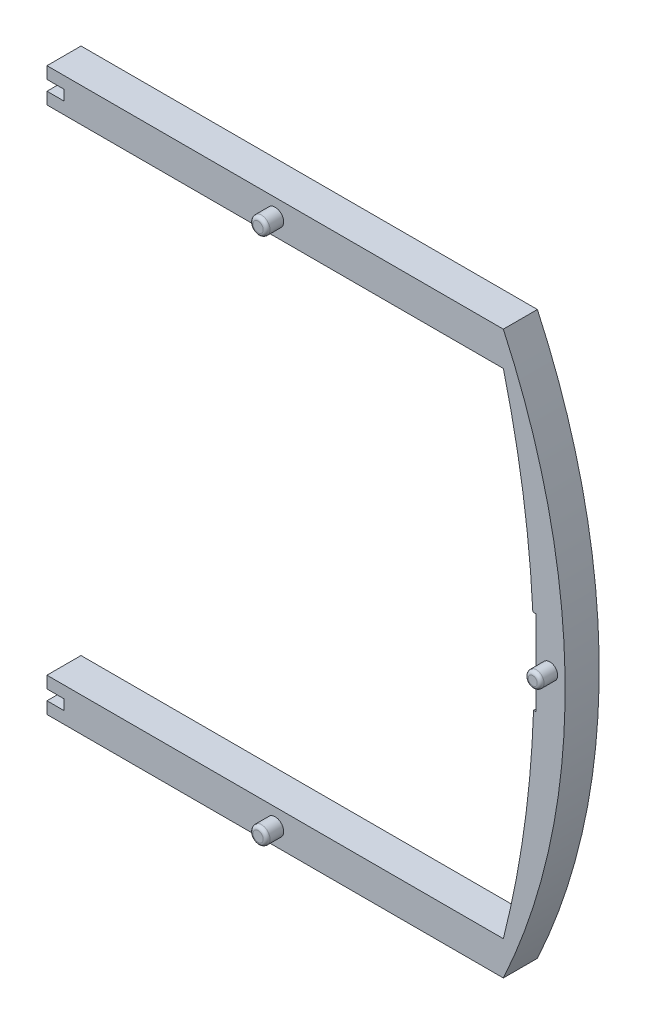
from build123d import *

# Parameters (mm, degrees)
ESQUISSE1_R         = 2.5
ESQUISSE1_R_2       = 2.313714448
BOSS_EXTRU_9_DEPTH  = 10
ESQUISSE1_31_W      = 3
ESQUISSE1_31_H      = 24.915622322
BOSS_EXTRU_10_DEPTH = 2
ESQUISSE1_32_R      = 2.313714448
ESQUISSE1_32_R_2    = 2.5
BOSS_EXTRU_11_DEPTH = 15
CONG_1_R            = 1
CONG_2_R            = 0.5


with BuildPart() as part:
    # Esquisse1 → Boss.-Extru.9 (new body)
    with BuildSketch(Plane.XY):
        with BuildLine():
            Line((115.224013388, -102.474855986), (-18.787756311, -102.474855986))
            Line((-18.787756311, -102.474855986), (-18.775986612, -105.974855986))
            Line((-18.775986612, -105.974855986), (-13.775986612, -105.974855986))
            Line((-13.775986612, -105.974855986), (-13.775986612, -108.974855986))
            Line((-13.775986612, -108.974855986), (-18.775986612, -108.974855986))
            Line((-18.775986612, -108.974855986), (-18.787756311, -112.474855986))
            Line((-18.787756311, -112.474855986), (115.224013388, -112.474855986))
            ThreePointArc((115.224013388, -112.474855986), (133.372740942, -29.974855986), (115.224013388, 52.525144014))
            Line((115.224013388, 52.525144014), (-18.775986612, 52.525144014))
            Line((-18.775986612, 52.525144014), (-18.775986612, 49.025144014))
            Line((-18.775986612, 49.025144014), (-13.775986612, 49.025144014))
            Line((-13.775986612, 49.025144014), (-13.775986612, 46.025144014))
            Line((-13.775986612, 46.025144014), (-18.775986612, 46.025144014))
            Line((-18.775986612, 46.025144014), (-18.775986612, 42.525144014))
            Line((-18.775986612, 42.525144014), (115.224013388, 42.525144014))
            ThreePointArc((115.224013388, 42.525144014), (120.975797216, 13.946843769), (123.882639826, -15.059233664))
            Line((123.882639826, -15.059233664), (124.791681137, -15.059233664))
            Line((124.791681137, -15.059233664), (124.791681137, -39.974855986))
            Line((124.791681137, -39.974855986), (124.090146574, -39.974855986))
            ThreePointArc((124.090146574, -39.974855986), (121.331451242, -71.462379164), (115.224013388, -102.474855986))
        make_face()
        with Locations((48.224013388, -107.474855986)):
            Circle(ESQUISSE1_R, mode=Mode.SUBTRACT)
        with Locations((128.863881441, -27.559233664)):
            Circle(ESQUISSE1_R_2, mode=Mode.SUBTRACT)
        with Locations((48.224013388, 47.525144014)):
            Circle(ESQUISSE1_R, mode=Mode.SUBTRACT)
    extrude(amount=BOSS_EXTRU_9_DEPTH)

    # Esquisse1<31> → Boss.-Extru.10 (add)
    with BuildSketch(Plane.XY):
        with Locations((123.291681137, -27.517044825)):
            Rectangle(ESQUISSE1_31_W, ESQUISSE1_31_H)
    extrude(amount=BOSS_EXTRU_10_DEPTH)

    # Esquisse1<32> → Boss.-Extru.11 (add)
    with BuildSketch(Plane.XY):
        with Locations((128.863881441, -27.559233664)):
            Circle(ESQUISSE1_32_R)
        with Locations((48.224013388, -107.474855986)):
            Circle(ESQUISSE1_32_R_2)
        with Locations((48.224013388, 47.525144014)):
            Circle(ESQUISSE1_32_R_2)
    extrude(amount=BOSS_EXTRU_11_DEPTH)

    # Congé1
    cong_1_edges = [part.edges().sort_by_distance(p)[0] for p in [
        (45.724013388, 47.525144014, 15),
        (126.550166993, -27.559233664, 15),
        (45.724013388, -107.474855986, 15),
    ]]
    fillet(cong_1_edges, radius=CONG_1_R)

    # Congé2
    cong_2_edges = [part.edges().sort_by_distance(p)[0] for p in [
        (121.791681137, -27.517044825, 0),
        (121.791681137, -27.517044825, 2),
    ]]
    fillet(cong_2_edges, radius=CONG_2_R)


solid = part.part
